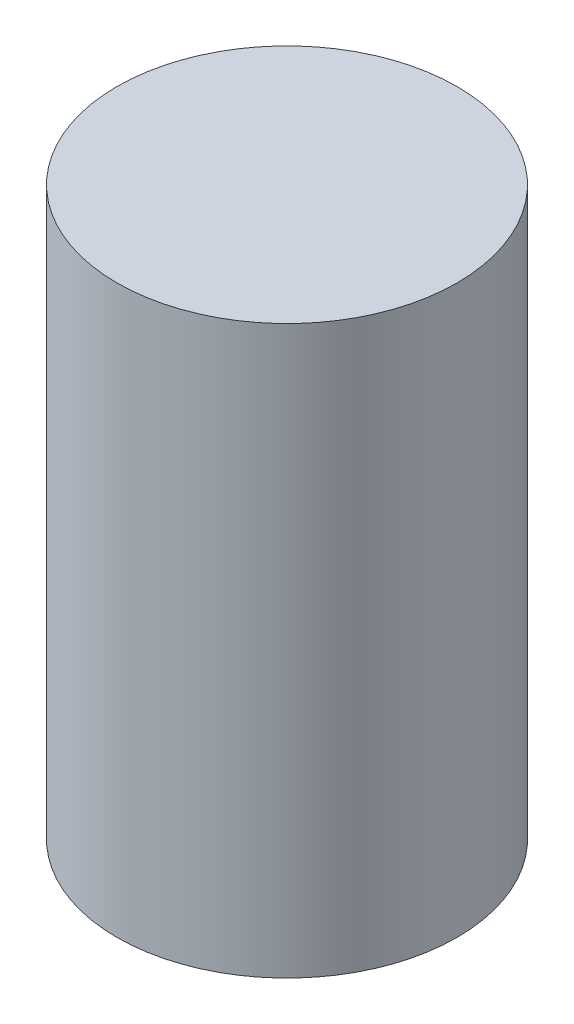
from build123d import *

# Parameters (mm, degrees)
SKETCH1_R           = 30
BOSS_EXTRUDE1_DEPTH = 100


with BuildPart() as part:
    # Sketch1 → Boss-Extrude1 (new body)
    with BuildSketch(Plane(origin=(0, 0, 0), x_dir=(1, 0, 0), z_dir=(0, 1, 0))):
        with Locations(Location((0, 0, 0), (0, 0, 270))):
            Circle(SKETCH1_R)
    extrude(amount=BOSS_EXTRUDE1_DEPTH)


solid = part.part
